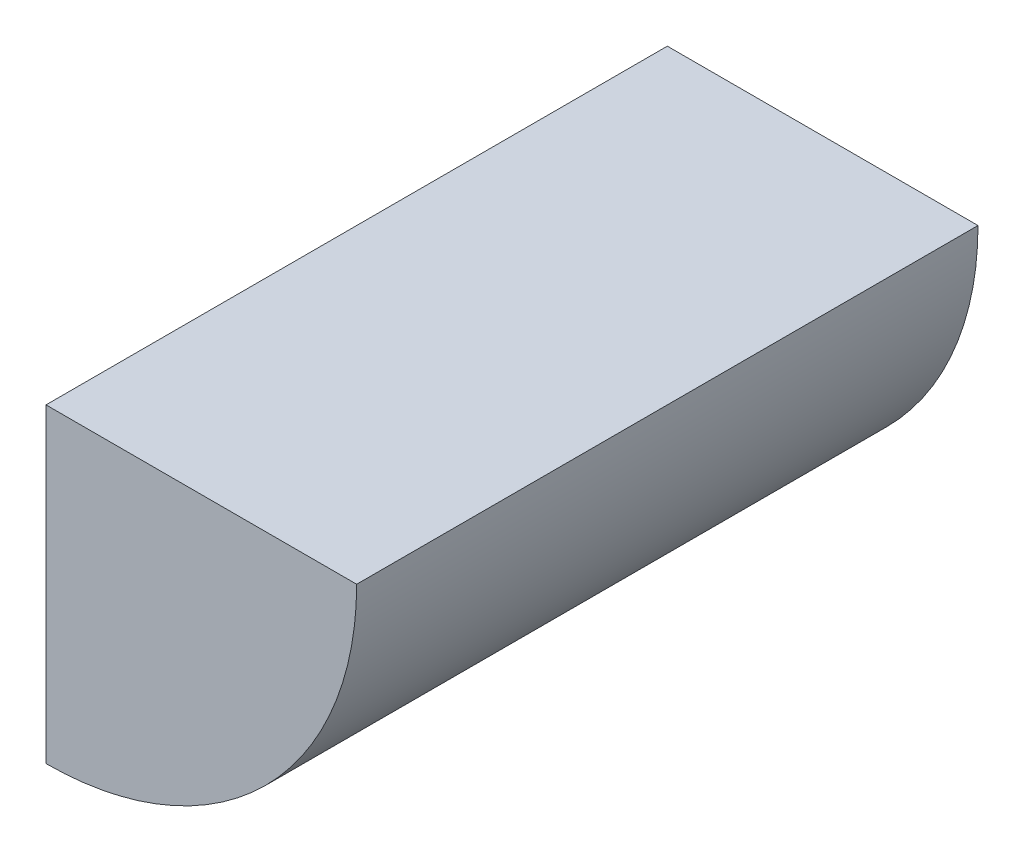
from build123d import *

# Parameters (mm, degrees)
SALIENTE_EXTRUIR1_DEPTH = 50
CROQUIS3_R              = 5
CORTAR_EXTRUIR1_DEPTH   = 10


with BuildPart() as part:
    # Croquis2 → Saliente-Extruir1 (new body)
    with BuildSketch(Plane.XY):
        with BuildLine():
            Line((0, 0), (0, -25))
            ThreePointArc((0, -25), (17.67766953, -17.67766953), (25, 0))
            Line((25, 0), (0, 0))
        make_face()
    extrude(amount=SALIENTE_EXTRUIR1_DEPTH)

    # Croquis3 → Cortar-Extruir1 (cut)
    with BuildSketch(Plane(origin=(0, 0, 0), x_dir=(-1, 0, 0), z_dir=(0, 0, -1))):
        with Locations((-10.126254825, -9.976532423)):
            Circle(CROQUIS3_R)
    extrude(amount=-CORTAR_EXTRUIR1_DEPTH, mode=Mode.SUBTRACT)


solid = part.part
